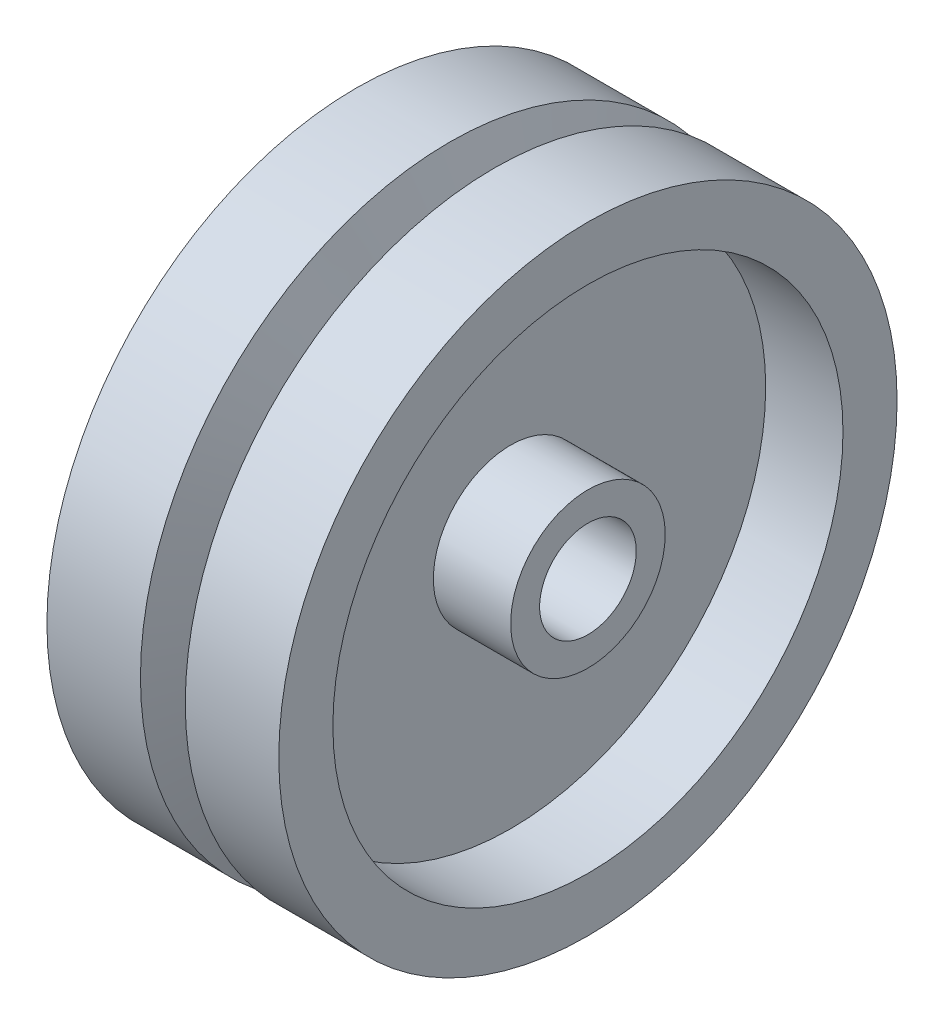
from build123d import *


with BuildPart() as part:
    # Sketch1 → Revolve1 (revolve)
    with BuildSketch(Plane.XY, mode=Mode.PRIVATE) as revolve1_sk:
        Polygon((-7.5, 3.125), (7.5, 3.125), (7.5, 5), (2.5, 5), (2.5, 16.5), (7.5, 16.5), (7.5, 20), (1.449747468, 20), (0, 16.5), (-1.449747468, 20), (-7.5, 20), (-7.5, 16.5), (-2.5, 16.5), (-2.5, 5), (-7.5, 5), align=None)
    revolve(revolve1_sk.sketch.rotate(Axis((0, 0, 0), (-1, 0, 0)), 90), axis=Axis((0, 0, 0), (-1, 0, 0)))


solid = part.part
